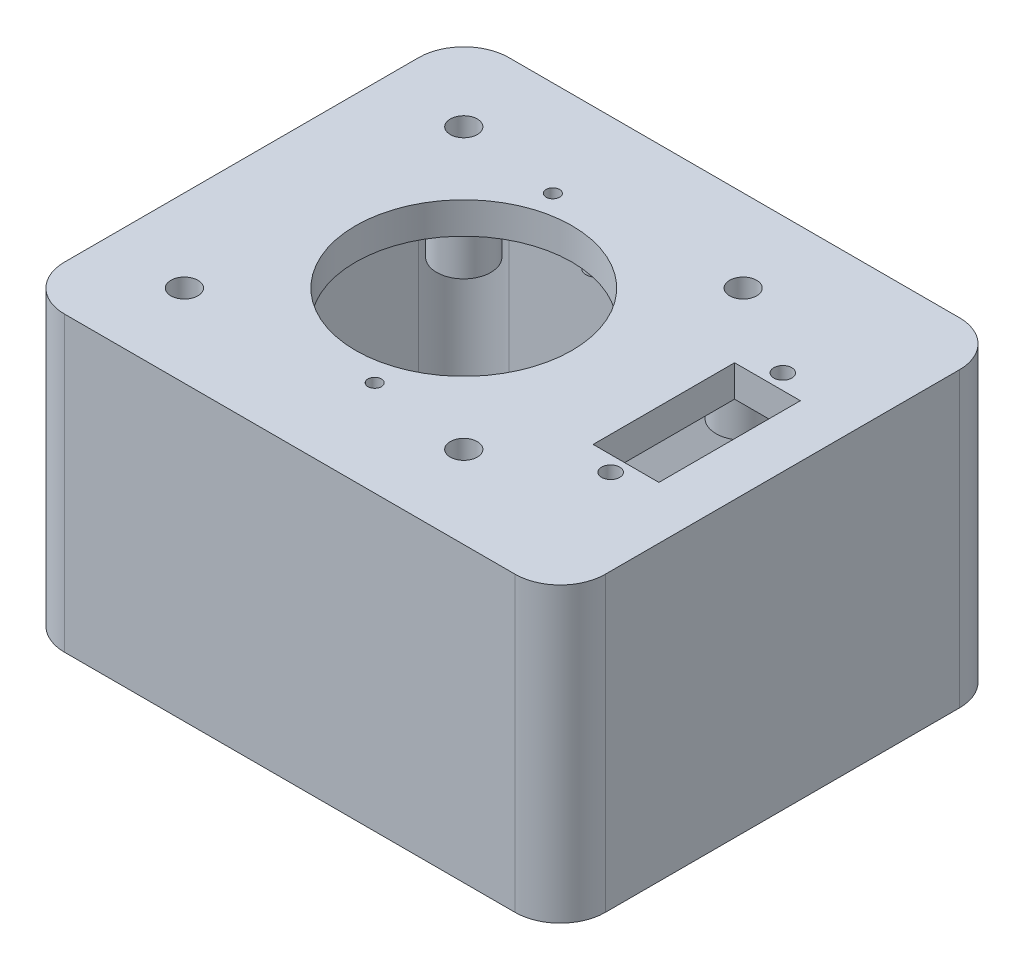
from build123d import *
from build123d.topology import SkipClean

# Parameters (mm, degrees)
SKETCH1_W           = 60
SKETCH1_H           = 49.3
SKETCH1_R           = 1.5
SKETCH1_R_2         = 0.75
SKETCH1_R_3         = 12
SKETCH1_R_4         = 1
SKETCH1_W_2         = 7.3
SKETCH1_H_2         = 15.7
BOSS_EXTRUDE1_DEPTH = 3.5
BOSS_EXTRUDE2_DEPTH = 29
SKETCH1_4_R         = 1.1
BOSS_EXTRUDE3_DEPTH = 2
FILLET1_R           = 5
BOSS_EXTRUDE4_START = 9
SKETCH2_R           = 3
SKETCH2_R_2         = 1.5
BOSS_EXTRUDE4_DEPTH = 9
FILLET2_R           = 1


with BuildPart() as part:
    # Sketch1 → Boss-Extrude1 (new body)
    with BuildSketch(Plane(origin=(0, 0, 0), x_dir=(1, 0, 0), z_dir=(0, 1, 0))):
        with Locations((5.35, 0)):
            Rectangle(SKETCH1_W, SKETCH1_H)
        with Locations(Location((-15.5, -15.5, 0), (0, 0, 270))):
            Circle(SKETCH1_R, mode=Mode.SUBTRACT)
        with Locations(Location((4.1608248, -14.046709116, 0), (0, 0, 270))):
            Circle(SKETCH1_R_2, mode=Mode.SUBTRACT)
        with Locations(Location((0, 0, 0), (0, 0, 270))):
            Circle(SKETCH1_R_3, mode=Mode.SUBTRACT)
        with Locations(Location((15.5, -15.5, 0), (0, 0, 270))):
            Circle(SKETCH1_R, mode=Mode.SUBTRACT)
        with Locations(Location((25.85, -9.55, 0), (0, 0, 270))):
            Circle(SKETCH1_R_4, mode=Mode.SUBTRACT)
        with Locations(Location((-15.5, 15.5, 0), (0, 0, 270))):
            Circle(SKETCH1_R, mode=Mode.SUBTRACT)
        with Locations(Location((-4.1608248, 14.046709116, 0), (0, 0, 270))):
            Circle(SKETCH1_R_2, mode=Mode.SUBTRACT)
        with Locations((25.85, 0)):
            Rectangle(SKETCH1_W_2, SKETCH1_H_2, mode=Mode.SUBTRACT)
        with Locations(Location((25.85, 9.55, 0), (0, 0, 90))):
            Circle(SKETCH1_R_4, mode=Mode.SUBTRACT)
        with Locations(Location((15.5, 15.5, 0), (0, 0, 270))):
            Circle(SKETCH1_R, mode=Mode.SUBTRACT)
    extrude(amount=BOSS_EXTRUDE1_DEPTH)

    # Sketch1<3> → Boss-Extrude2 (add)
    with BuildSketch(Plane(origin=(0, 0, 0), x_dir=(1, 0, 0), z_dir=(0, 1, 0))):
        Polygon((24.65, 24.65), (-24.65, 24.65), (-24.65, -24.65), (24.65, -24.65), (35.35, -24.65), (35.35, 24.65), align=None)
        Polygon((-21.15, -21.15), (-21.15, 21.15), (21.15, 21.15), (31.85, 21.15), (31.85, -21.15), (21.15, -21.15), align=None, mode=Mode.SUBTRACT)
    extrude(amount=-BOSS_EXTRUDE2_DEPTH)

    # Sketch1<4> → Boss-Extrude3 (add)
    with BuildSketch(Plane(origin=(0, 0, 0), x_dir=(1, 0, 0), z_dir=(0, 1, 0))):
        with Locations(Location((0, 14.65, 0), (0, 0, 270))):
            Circle(SKETCH1_4_R)
        with Locations(Location((0, -14.65, 0), (0, 0, 270))):
            Circle(SKETCH1_4_R)
    extrude(amount=-BOSS_EXTRUDE3_DEPTH)

    # Fillet1
    fillet1_edges = [part.edges().sort_by_distance(p)[0] for p in [
        (35.35, -12.75, 24.65),
        (-24.65, -12.75, 24.65),
        (-24.65, -12.75, -24.65),
        (35.35, -12.75, -24.65),
        (31.85, -14.5, -21.15),
        (-21.15, -14.5, -21.15),
        (-21.15, -14.5, 21.15),
        (31.85, -14.5, 21.15),
    ]]
    fillet(fillet1_edges, radius=FILLET1_R)

    # Sketch2 → Boss-Extrude4 (add)
    # profile 1 of 4: a face of its own
    with SkipClean():  # the faces are left unmerged after this step: merging them gives an invalid solid
        with BuildSketch(Plane.XZ.offset(BOSS_EXTRUDE4_START)):
            with Locations(Location((-15.5, 15.5, 0), (0, 0, 90))):
                Circle(SKETCH2_R)
            with Locations(Location((-15.5, 15.5, 0), (0, 0, 270))):
                Circle(SKETCH2_R_2, mode=Mode.SUBTRACT)
        # profile 2 of 4: a face of its own
        with BuildSketch(Plane.XZ.offset(BOSS_EXTRUDE4_START)):
            with Locations(Location((15.5, 15.5, 0), (0, 0, 90))):
                Circle(SKETCH2_R)
            with Locations(Location((15.5, 15.5, 0), (0, 0, 270))):
                Circle(SKETCH2_R_2, mode=Mode.SUBTRACT)
        # profile 3 of 4: a face of its own
        with BuildSketch(Plane.XZ.offset(BOSS_EXTRUDE4_START)):
            with Locations(Location((15.5, -15.5, 0), (0, 0, 90))):
                Circle(SKETCH2_R)
            with Locations(Location((15.5, -15.5, 0), (0, 0, 270))):
                Circle(SKETCH2_R_2, mode=Mode.SUBTRACT)
        # profile 4 of 4: a face of its own
        with BuildSketch(Plane.XZ.offset(BOSS_EXTRUDE4_START)):
            with Locations(Location((-15.5, -15.5, 0), (0, 0, 90))):
                Circle(SKETCH2_R)
            with Locations(Location((-15.5, -15.5, 0), (0, 0, 270))):
                Circle(SKETCH2_R_2, mode=Mode.SUBTRACT)
        extrude(amount=-BOSS_EXTRUDE4_DEPTH)

    # Fillet2
    fillet2_edges = [part.edges().sort_by_distance(p)[0] for p in [
        (31.85, 0, 0),
        (-21.15, 0, 0),
        (5.35, 0, -21.15),
        (5.35, 0, 21.15),
        (-19.685533906, 0, -19.685533906),
        (-19.685533906, 0, 19.685533906),
        (30.385533906, 0, -19.685533906),
        (30.385533906, 0, 19.685533906),
        (-15.5, 0, 12.5),
        (15.5, 0, 12.5),
        (15.5, 0, -18.5),
        (-15.5, 0, -18.5),
    ]]
    fillet(fillet2_edges, radius=FILLET2_R)


solid = part.part
